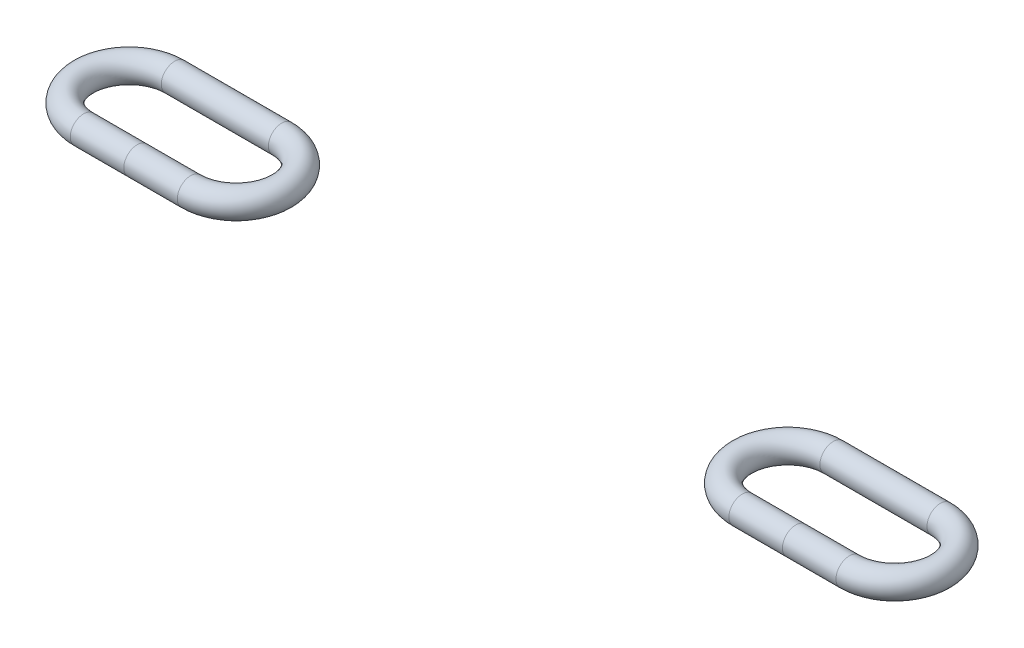
from build123d import *

# Parameters (mm, degrees)
SKETCH_2_R = 0.25


with BuildPart() as part:
    # 扫描1: sweep along a path in 草图1
    with BuildLine(Plane(origin=(0, 0, 0), x_dir=(1, 0, 0), z_dir=(0, 1, 0))) as sweep_1_path:
        Line((-1, 0.85), (1, 0.85))
        ThreePointArc((1, 0.85), (1.85, 0), (1, -0.85))
        Line((1, -0.85), (-1, -0.85))
        ThreePointArc((-1, -0.85), (-1.85, 0), (-1, 0.85))
    # 草图2 → 扫描1 (sweep)
    with BuildSketch(Plane(origin=(0, 0, 0), x_dir=(0, 0, -1), z_dir=(1, 0, 0))):
        with Locations((-0.85, 0)):
            Circle(SKETCH_2_R)
    sweep(path=sweep_1_path.line)


with BuildPart() as body_2:
    # 镜向3: mirrored copy
    add(part.part.mirror(Plane(origin=(-6.15, 0, 0), x_dir=(0, 0, 1), z_dir=(1, 0, 0))))


solid = Compound([part.part, body_2.part])
